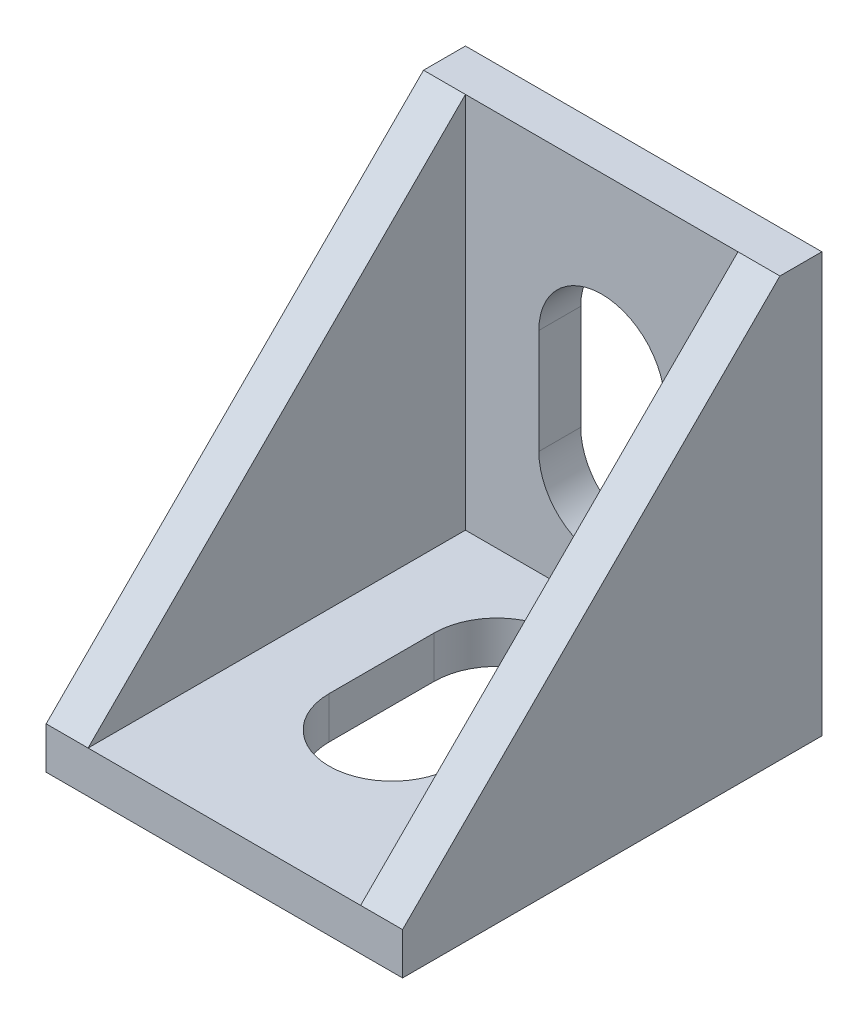
from build123d import *

# Parameters (mm, degrees)
SKETCH1_W               = 17
SKETCH1_H               = 20
BOSS_EXTRUDE1_DEPTH     = 20
SKETCH2_W               = 13
SKETCH2_H               = 18
CUT_EXTRUDE1_DEPTH      = 18
CUT_EXTRUDE2_DEPTH      = 29.08914381
CUT_EXTRUDE2_DEPTH_BACK = 29.08914381
CUT_EXTRUDE3_REACH      = 30.218
CUT_EXTRUDE4_REACH      = 24.277
BOSS_EXTRUDE2_DEPTH     = 1
BOSS_EXTRUDE3_DEPTH     = 1


with BuildPart() as part:
    # Sketch1 → Boss-Extrude1 (new body)
    with BuildSketch(Plane.XY):
        Rectangle(SKETCH1_W, SKETCH1_H)
    extrude(amount=BOSS_EXTRUDE1_DEPTH)

    # Sketch2 → Cut-Extrude1 (cut)
    with BuildSketch(Plane(origin=(0, 10, 0), x_dir=(1, 0, 0), z_dir=(0, 1, 0))):
        with Locations((0, -11)):
            Rectangle(SKETCH2_W, SKETCH2_H)
    extrude(amount=-CUT_EXTRUDE1_DEPTH, mode=Mode.SUBTRACT)

    # Sketch3 → Cut-Extrude2 (cut, two sides: drawn at the far end of the back side and taken through both)
    with BuildSketch(Plane(origin=(8.5, 0, 0), x_dir=(0, 0, -1), z_dir=(1, 0, 0)).offset(-CUT_EXTRUDE2_DEPTH_BACK)):
        Polygon((-2, 10), (-20, -8), (-20, 10), align=None)
    extrude(amount=CUT_EXTRUDE2_DEPTH + CUT_EXTRUDE2_DEPTH_BACK, mode=Mode.SUBTRACT)

    # Sketch4 → Cut-Extrude3 (cut, up to next)
    with BuildSketch(Plane(origin=(0, -8, 0), x_dir=(1, 0, 0), z_dir=(0, 1, 0)), mode=Mode.PRIVATE) as cut_extrude3_sk1:
        with BuildLine():
            Line((-3, -12), (-3, -7))
            ThreePointArc((-3, -7), (0, -4), (3, -7))
            Line((3, -7), (3, -12))
            ThreePointArc((3, -12), (0, -15), (-3, -12))
        make_face()
    cut_extrude3_tool1 = extrude(cut_extrude3_sk1.sketch, amount=-CUT_EXTRUDE3_REACH, mode=Mode.PRIVATE) & part.part
    add(cut_extrude3_tool1.solids().sort_by_distance((0, -8, 9.5))[0], mode=Mode.SUBTRACT)

    # Sketch5 → Cut-Extrude4 (cut, up to next)
    with BuildSketch(Plane.XY.offset(2), mode=Mode.PRIVATE) as cut_extrude4_sk1:
        with BuildLine():
            Line((-3, -3), (-3, 2))
            ThreePointArc((-3, 2), (0, 5), (3, 2))
            Line((3, 2), (3, -3))
            ThreePointArc((3, -3), (0, -6), (-3, -3))
        make_face()
    cut_extrude4_tool1 = extrude(cut_extrude4_sk1.sketch, amount=-CUT_EXTRUDE4_REACH, mode=Mode.PRIVATE) & part.part
    add(cut_extrude4_tool1.solids().sort_by_distance((0, -0.5, 2))[0], mode=Mode.SUBTRACT)

    # Sketch6 → Boss-Extrude2 (add)
    with BuildSketch(Plane.XZ.offset(10)):
        with BuildLine():
            Line((-1, 19), (1, 19))
            ThreePointArc((1, 19), (2, 18), (1, 17))
            Line((1, 17), (-1, 17))
            ThreePointArc((-1, 17), (-2, 18), (-1, 19))
        make_face()
        with BuildLine():
            Line((-1, 3), (1, 3))
            ThreePointArc((1, 3), (2, 2), (1, 1))
            Line((1, 1), (-1, 1))
            ThreePointArc((-1, 1), (-2, 2), (-1, 3))
        make_face()
    extrude(amount=BOSS_EXTRUDE2_DEPTH)

    # Sketch7 → Boss-Extrude3 (add)
    with BuildSketch(Plane(origin=(0, 0, 0), x_dir=(-1, 0, 0), z_dir=(0, 0, -1))):
        with BuildLine():
            Line((1, -9), (-1, -9))
            ThreePointArc((-1, -9), (-2, -8), (-1, -7))
            Line((-1, -7), (1, -7))
            ThreePointArc((1, -7), (2, -8), (1, -9))
        make_face()
        with BuildLine():
            Line((1, 7), (-1, 7))
            ThreePointArc((-1, 7), (-2, 8), (-1, 9))
            Line((-1, 9), (1, 9))
            ThreePointArc((1, 9), (2, 8), (1, 7))
        make_face()
    extrude(amount=BOSS_EXTRUDE3_DEPTH)


solid = part.part
